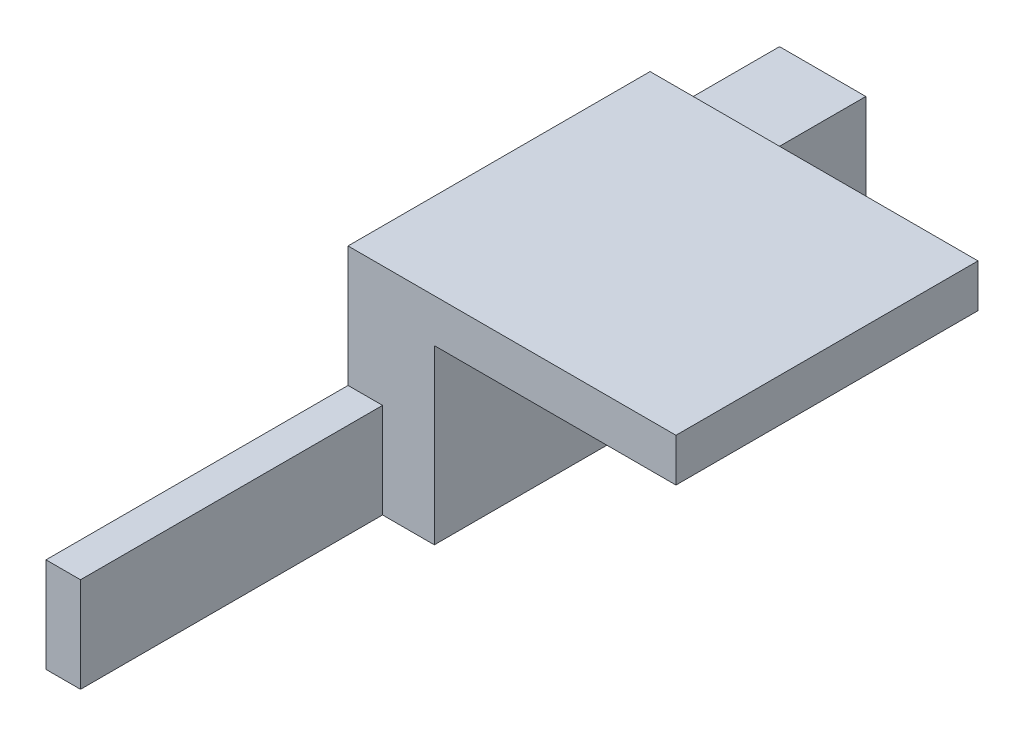
from build123d import *

# Parameters (mm, degrees)
SKETCH_1_W          = 38
SKETCH_1_H          = 35
EXTRUDE_1_DEPTH     = 5
SKETCH_1_14_W       = 10
SKETCH_1_14_H       = 50
EXTRUDE_2_DEPTH     = 20
EXTRUDE_START       = -10
SKETCH_2_W          = 35
SKETCH_2_H          = 11
EXTRUDE_3_DEPTH     = 4
CUT_EXTRUDE_START   = -10
SKETCH_2_3_R        = 3.1
CUT_EXTRUDE_1_DEPTH = 3


with BuildPart() as part:
    # 草图1 → 凸台-拉伸1 (new body)
    with BuildSketch(Plane(origin=(0, 0, 0), x_dir=(1, 0, 0), z_dir=(0, 1, 0))):
        with Locations((19, -17.5)):
            Rectangle(SKETCH_1_W, SKETCH_1_H)
    extrude(amount=EXTRUDE_1_DEPTH)

    # 草图1<14> → 凸台-拉伸2 (add)
    with BuildSketch(Plane(origin=(0, 0, 0), x_dir=(1, 0, 0), z_dir=(0, 1, 0))):
        with Locations((5, -10)):
            Rectangle(SKETCH_1_14_W, SKETCH_1_14_H)
    extrude(amount=-EXTRUDE_2_DEPTH)

    # 草图2 → 凸台-拉伸3 (add)
    with BuildSketch(Plane(origin=(10, 0, 0), x_dir=(0, 0, -1), z_dir=(1, 0, 0)).offset(EXTRUDE_START)):
        with Locations((-52.5, -14.5)):
            Rectangle(SKETCH_2_W, SKETCH_2_H)
    extrude(amount=EXTRUDE_3_DEPTH)

    # 草图2<3> → 切除-拉伸1 (cut)
    with BuildSketch(Plane(origin=(10, 0, 0), x_dir=(0, 0, -1), z_dir=(1, 0, 0)).offset(CUT_EXTRUDE_START)):
        with Locations((-29.4, -14.5)):
            Circle(SKETCH_2_3_R)
        with Locations((-51.7, -14.5)):
            Circle(SKETCH_2_3_R)
    extrude(amount=CUT_EXTRUDE_1_DEPTH, mode=Mode.SUBTRACT)


solid = part.part
